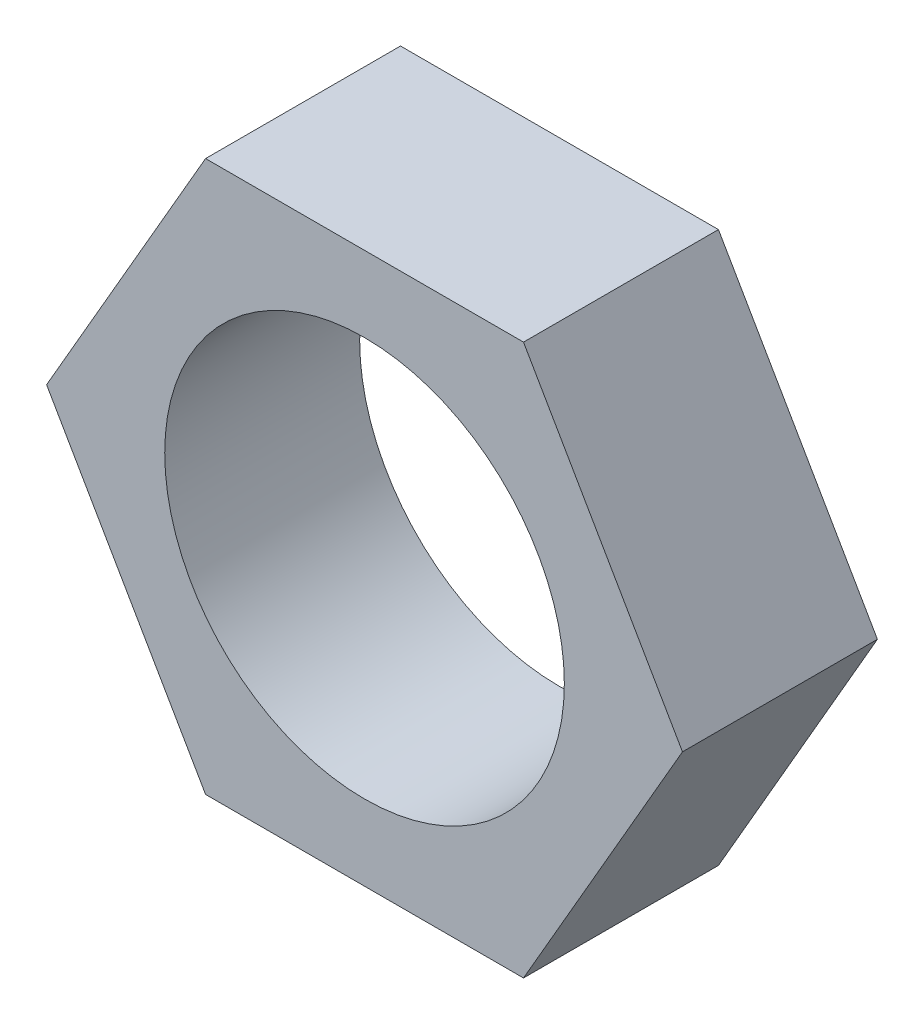
from build123d import *

# Parameters (mm, degrees)
BOSS_EXTRUDE1_DEPTH     = 2
CUT_EXTRUDE1_DEPTH      = 9.859223066
CUT_EXTRUDE1_DEPTH_BACK = 9.859223066
SKETCH3_R               = 4.1


with BuildPart() as part:
    # Sketch1 → Boss-Extrude1 (new, symmetric)
    with BuildSketch(Plane.XY):
        Polygon((3.262029021, 5.65), (-3.262029021, 5.65), (-6.524058042, 0), (-3.262029021, -5.65), (3.262029021, -5.65), (6.524058042, 0), align=None)
    extrude(amount=BOSS_EXTRUDE1_DEPTH, both=True)

    # Sketch3 → Cut-Extrude1 (cut, two sides: drawn at the far end of the back side and taken through both)
    with BuildSketch(Plane.XY.offset(-CUT_EXTRUDE1_DEPTH_BACK)):
        Circle(SKETCH3_R)
    extrude(amount=CUT_EXTRUDE1_DEPTH + CUT_EXTRUDE1_DEPTH_BACK, mode=Mode.SUBTRACT)


solid = part.part
